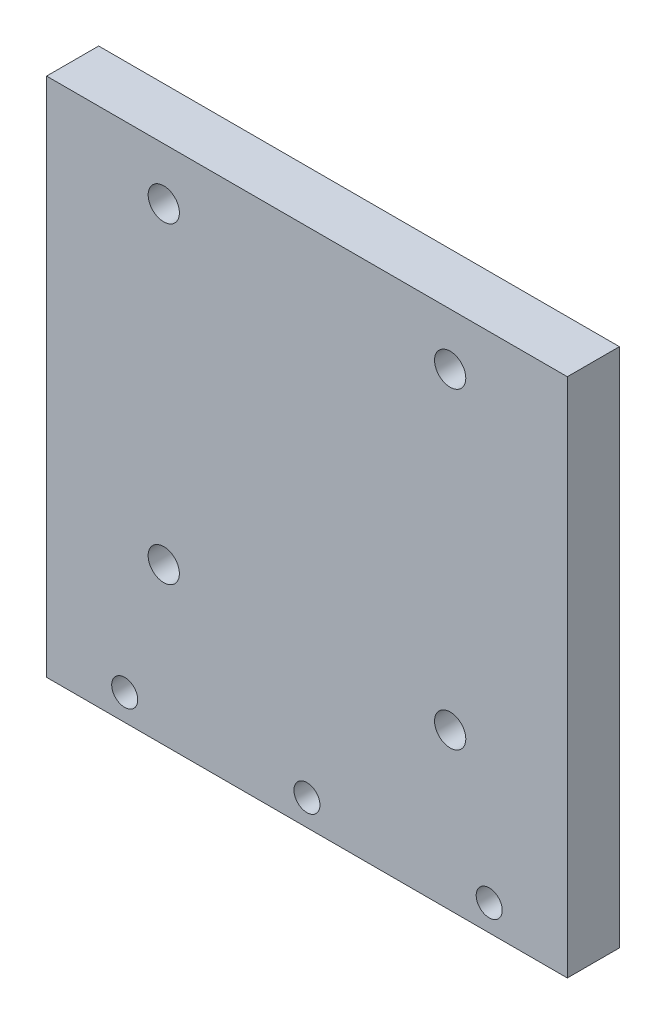
from build123d import *

# Parameters (mm, degrees)
SKETCH2_W           = 100
SKETCH2_H           = 80
SKETCH2_R           = 3
BOSS_EXTRUDE1_DEPTH = 10
SKETCH3_W           = 100
SKETCH3_H           = 10
BOSS_EXTRUDE2_DEPTH = 20
CUT_EXTRUDE1_REACH  = 82.336
SKETCH4_R           = 2.5


with BuildPart() as part:
    # Sketch2 → Boss-Extrude1 (new body)
    with BuildSketch(Plane.XY):
        with Locations((0, -2.079062729)):
            Rectangle(SKETCH2_W, SKETCH2_H)
        with Locations((27.5, 27.920937271)):
            Circle(SKETCH2_R, mode=Mode.SUBTRACT)
        with Locations((-27.5, 27.920937271)):
            Circle(SKETCH2_R, mode=Mode.SUBTRACT)
        with Locations(Location((-27.5, -32.079062729, 0), (0, 0, 180))):
            Circle(SKETCH2_R, mode=Mode.SUBTRACT)
        with Locations(Location((27.5, -32.079062729, 0), (0, 0, 180))):
            Circle(SKETCH2_R, mode=Mode.SUBTRACT)
    extrude(amount=BOSS_EXTRUDE1_DEPTH)

    # Sketch3 → Boss-Extrude2 (add)
    with BuildSketch(Plane.XZ.offset(42.079062729)):
        with Locations((0, 5)):
            Rectangle(SKETCH3_W, SKETCH3_H)
    extrude(amount=BOSS_EXTRUDE2_DEPTH)

    # Sketch4 → Cut-Extrude1 (cut, up to next)
    with BuildSketch(Plane.XY.offset(10), mode=Mode.PRIVATE) as cut_extrude1_sk1:
        with Locations((0, -57.079062729)):
            Circle(SKETCH4_R)
    cut_extrude1_tool1 = extrude(cut_extrude1_sk1.sketch, amount=-CUT_EXTRUDE1_REACH, mode=Mode.PRIVATE) & part.part
    # Sketch4 → Cut-Extrude1 (cut, up to next)
    with BuildSketch(Plane.XY.offset(10), mode=Mode.PRIVATE) as cut_extrude1_sk2:
        with Locations((-35, -57.079062729)):
            Circle(SKETCH4_R)
    cut_extrude1_tool2 = extrude(cut_extrude1_sk2.sketch, amount=-CUT_EXTRUDE1_REACH, mode=Mode.PRIVATE) & part.part
    # Sketch4 → Cut-Extrude1 (cut, up to next)
    with BuildSketch(Plane.XY.offset(10), mode=Mode.PRIVATE) as cut_extrude1_sk3:
        with Locations((35, -57.079062729)):
            Circle(SKETCH4_R)
    cut_extrude1_tool3 = extrude(cut_extrude1_sk3.sketch, amount=-CUT_EXTRUDE1_REACH, mode=Mode.PRIVATE) & part.part
    add(cut_extrude1_tool1.solids().sort_by_distance((0, -57.079063, 10))[0], mode=Mode.SUBTRACT)
    add(cut_extrude1_tool2.solids().sort_by_distance((-35, -57.079063, 10))[0], mode=Mode.SUBTRACT)
    add(cut_extrude1_tool3.solids().sort_by_distance((35, -57.079063, 10))[0], mode=Mode.SUBTRACT)


solid = part.part
